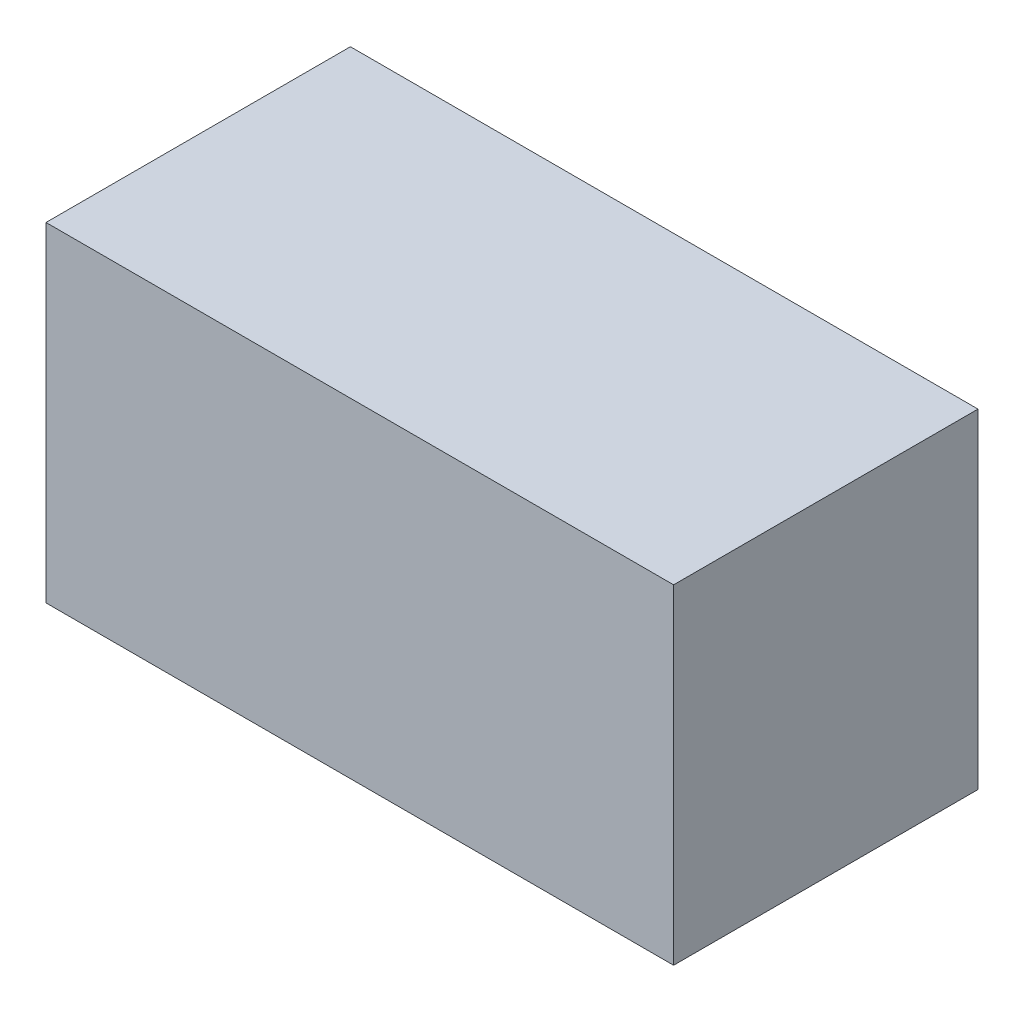
from build123d import *

# Parameters (mm, degrees)
SKETCH1_W           = 20
SKETCH1_H           = 9.7
BOSS_EXTRUDE1_DEPTH = 10.5


with BuildPart() as part:
    # Sketch1 → Boss-Extrude1 (new body)
    with BuildSketch(Plane(origin=(0, 0, 0), x_dir=(1, 0, 0), z_dir=(0, 1, 0))):
        with Locations((10, 4.85)):
            Rectangle(SKETCH1_W, SKETCH1_H)
    extrude(amount=BOSS_EXTRUDE1_DEPTH)


solid = part.part
